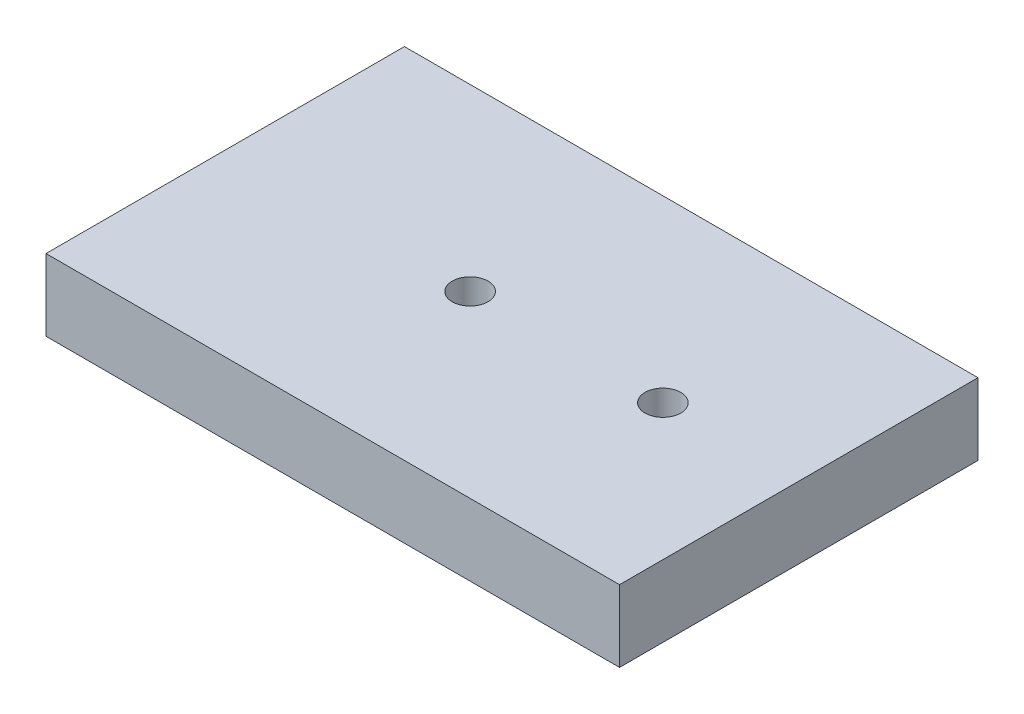
from build123d import *

# Parameters (mm, degrees)
CROQUIS1_W              = 160
CROQUIS1_H              = 100
SALIENTE_EXTRUIR1_DEPTH = 20
CROQUIS2_R              = 5
CORTAR_EXTRUIR1_DEPTH   = 9.8


with BuildPart() as part:
    # Croquis1 → Saliente-Extruir1 (new body)
    with BuildSketch(Plane(origin=(0, 0, 0), x_dir=(1, 0, 0), z_dir=(0, 1, 0))):
        Rectangle(CROQUIS1_W, CROQUIS1_H)
    extrude(amount=SALIENTE_EXTRUIR1_DEPTH)

    # Croquis2 → Cortar-Extruir1 (cut)
    with BuildSketch(Plane(origin=(0, 20, 0), x_dir=(1, 0, 0), z_dir=(0, 1, 0))):
        with Locations(Location((-11.685621738, 0, 0), (0, 0, 270))):
            Circle(CROQUIS2_R)
        with Locations(Location((42.094378262, 0, 0), (0, 0, 270))):
            Circle(CROQUIS2_R)
    extrude(amount=-CORTAR_EXTRUIR1_DEPTH, mode=Mode.SUBTRACT)


solid = part.part
